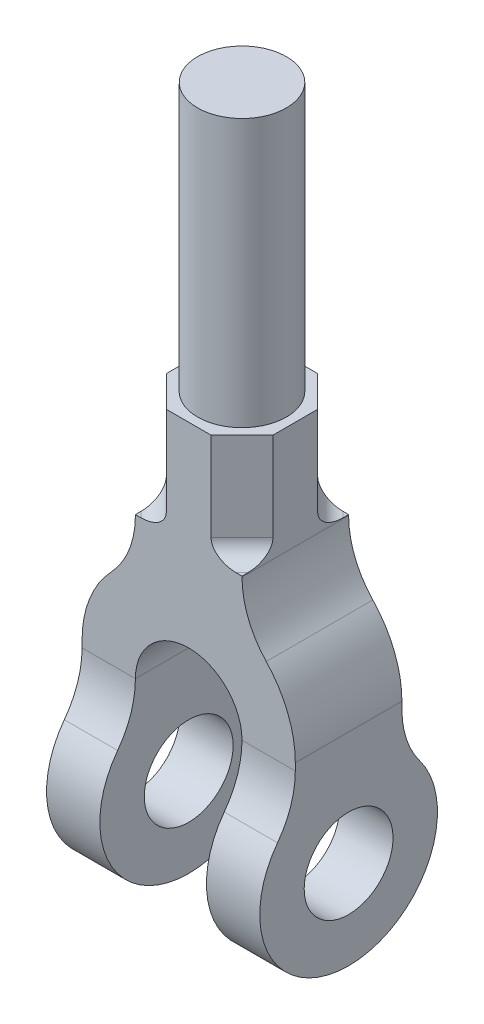
from build123d import *

# Parameters (mm, degrees)
SKETCH1_W           = 120
SKETCH1_H           = 250
BOSS_EXTRUDE1_DEPTH = 100
CUT_EXTRUDE1_DEPTH  = 100
CUT_EXTRUDE2_DEPTH  = 240
SKETCH4_4_R         = 25
CUT_EXTRUDE3_DEPTH  = 240
CUT_EXTRUDE4_DEPTH  = 60
SKETCH5_3_R         = 25
BOSS_EXTRUDE2_DEPTH = 150.7
FILLET1_R           = 10


with BuildPart() as part:
    # Sketch1 → Boss-Extrude1 (new body)
    with BuildSketch(Plane.XY):
        Rectangle(SKETCH1_W, SKETCH1_H)
    extrude(amount=BOSS_EXTRUDE1_DEPTH)

    # Sketch2 → Cut-Extrude1 (cut)
    with BuildSketch(Plane.XY.offset(100)):
        with BuildLine():
            ThreePointArc((30, -15), (21.213203436, 6.213203436), (0, 15))
            ThreePointArc((0, 15), (-21.213203436, 6.213203436), (-30, -15))
            Line((-30, -15), (-30, -125))
            Line((-30, -125), (30, -125))
            Line((30, -125), (30, -15))
        make_face()
        with BuildLine():
            Line((60, 125), (30, 125))
            Line((30, 125), (30, 64.498344353))
            ThreePointArc((30, 64.498344353), (33.533981136, 46.034620706), (43.636363636, 30.180915101))
            ThreePointArc((43.636363636, 30.180915101), (55.759222645, 11.156468358), (60, -11.00000004))
            Line((60, -11.00000004), (60, 125))
        make_face()
        with BuildLine():
            Line((-30, 64.498344353), (-30, 125))
            Line((-30, 125), (-60, 125))
            Line((-60, 125), (-60, -11))
            ThreePointArc((-60, -11), (-55.759222637, 11.156468376), (-43.636363636, 30.180915101))
            ThreePointArc((-43.636363636, 30.180915101), (-33.533981136, 46.034620706), (-30, 64.498344353))
        make_face()
    extrude(amount=-CUT_EXTRUDE1_DEPTH, mode=Mode.SUBTRACT)

    # Sketch4 → Cut-Extrude2 (cut)
    with BuildSketch(Plane(origin=(70, 0, 0), x_dir=(0, 0, -1), z_dir=(1, 0, 0))):
        with BuildLine():
            Line((-100, -75), (-100, -125))
            Line((-100, -125), (-50, -125))
            ThreePointArc((-50, -125), (-85.355339059, -110.355339059), (-100, -75))
        make_face()
        with BuildLine():
            Line((-100, 125), (-100, -75))
            ThreePointArc((-100, -75), (-97.434164903, -59.188611699), (-90, -45))
            ThreePointArc((-90, -45), (-82.565835097, -30.811388301), (-80, -15))
            Line((-80, -15), (-80, 125))
            Line((-80, 125), (-100, 125))
        make_face()
        with BuildLine():
            ThreePointArc((0, -75.000000253), (-14.64466103, -110.355339149), (-50, -125))
            Line((-50, -125), (0, -125))
            Line((0, -125), (0, -75.000000253))
        make_face()
        with BuildLine():
            ThreePointArc((-10, -45), (-2.565835058, -59.188611819), (0, -75.000000253))
            Line((0, -75.000000253), (0, 125))
            Line((0, 125), (-20, 125))
            Line((-20, 125), (-20, -15))
            ThreePointArc((-20, -15), (-17.434164903, -30.811388301), (-10, -45))
        make_face()
    extrude(amount=-CUT_EXTRUDE2_DEPTH, mode=Mode.SUBTRACT)

    # Sketch4<4> → Cut-Extrude3 (cut)
    with BuildSketch(Plane(origin=(70, 0, 0), x_dir=(0, 0, -1), z_dir=(1, 0, 0))):
        with Locations((-50, -75)):
            Circle(SKETCH4_4_R)
    extrude(amount=-CUT_EXTRUDE3_DEPTH, mode=Mode.SUBTRACT)

    # Sketch5 → Cut-Extrude4 (cut)
    with BuildSketch(Plane(origin=(0, 125, 0), x_dir=(1, 0, 0), z_dir=(0, 1, 0))):
        Polygon((-30, -62.6), (-30, -80), (-12.6, -80), align=None)
        Polygon((-30, -20), (-30, -37.4), (-12.6, -20), align=None)
        Polygon((30, -62.6), (12.6, -80), (30, -80), align=None)
        Polygon((12.6, -20), (30, -37.4), (30, -20), align=None)
    extrude(amount=-CUT_EXTRUDE4_DEPTH, mode=Mode.SUBTRACT)

    # Sketch5<3> → Boss-Extrude2 (add)
    with BuildSketch(Plane(origin=(0, 125, 0), x_dir=(1, 0, 0), z_dir=(0, 1, 0))):
        with Locations((0, -50)):
            Circle(SKETCH5_3_R)
    extrude(amount=BOSS_EXTRUDE2_DEPTH)

    # Fillet1
    fillet1_edges = [part.edges().sort_by_distance(p)[0] for p in [
        (-21.3, 65, 71.3),
        (-21.3, 65, 28.7),
        (21.3, 65, 28.7),
        (21.3, 65, 71.3),
    ]]
    fillet(fillet1_edges, radius=FILLET1_R)


solid = part.part
